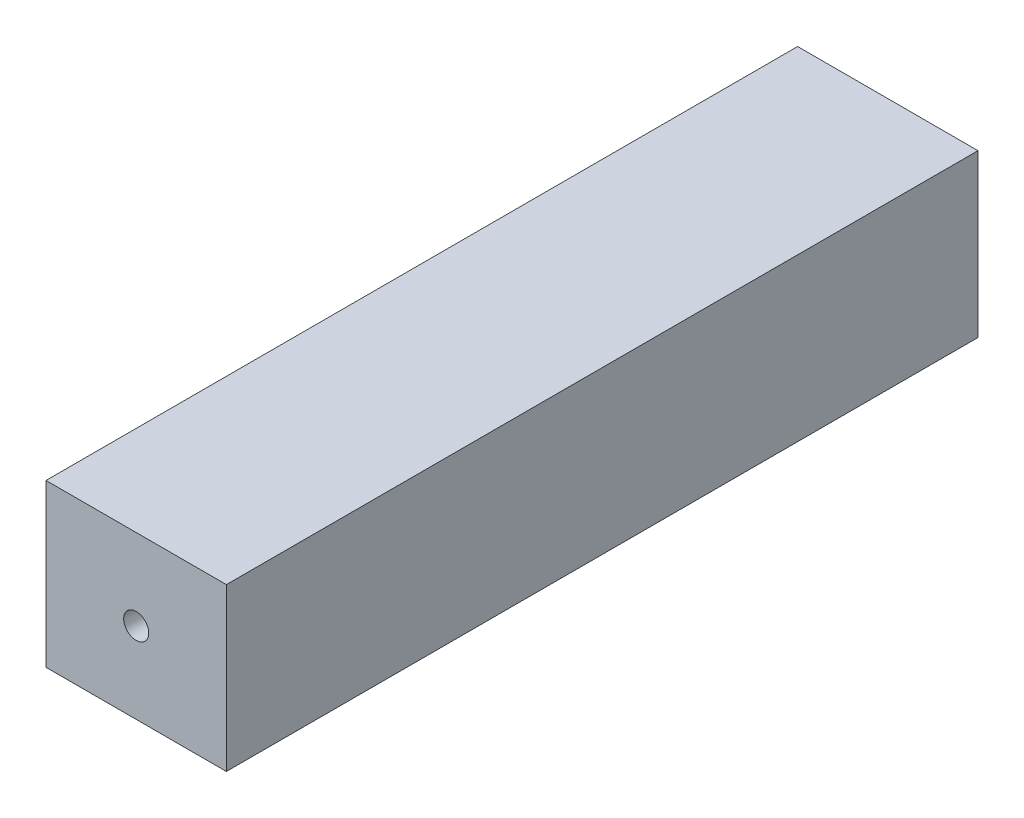
from build123d import *

# Parameters (mm, degrees)
SKETCH_2_W             = 36
SKETCH_2_H             = 32.3
EXTRUDE_1_DEPTH        = 150
HOLE_WIZARD_M6_1_D     = 5
HOLE_WIZARD_M6_1_DEPTH = 7
HOLE_WIZARD_M6_1_TIP   = 1.502151548


with BuildPart() as part:
    # 草图2 → 凸台-拉伸1 (new body)
    with BuildSketch(Plane.XY):
        with Locations((-93.410859233, 18.668666464)):
            Rectangle(SKETCH_2_W, SKETCH_2_H)
    extrude(amount=EXTRUDE_1_DEPTH)

    # M6 螺纹孔1
    with Locations(Plane.XY.offset(150)):
        with Locations((-93.410859233, 18.668666464)):
            Hole(HOLE_WIZARD_M6_1_D / 2, depth=HOLE_WIZARD_M6_1_DEPTH)
            with Locations((0, 0, -(HOLE_WIZARD_M6_1_DEPTH + HOLE_WIZARD_M6_1_TIP / 2))):  # 118° drill point
                Cone(0, HOLE_WIZARD_M6_1_D / 2, HOLE_WIZARD_M6_1_TIP, mode=Mode.SUBTRACT)


solid = part.part
